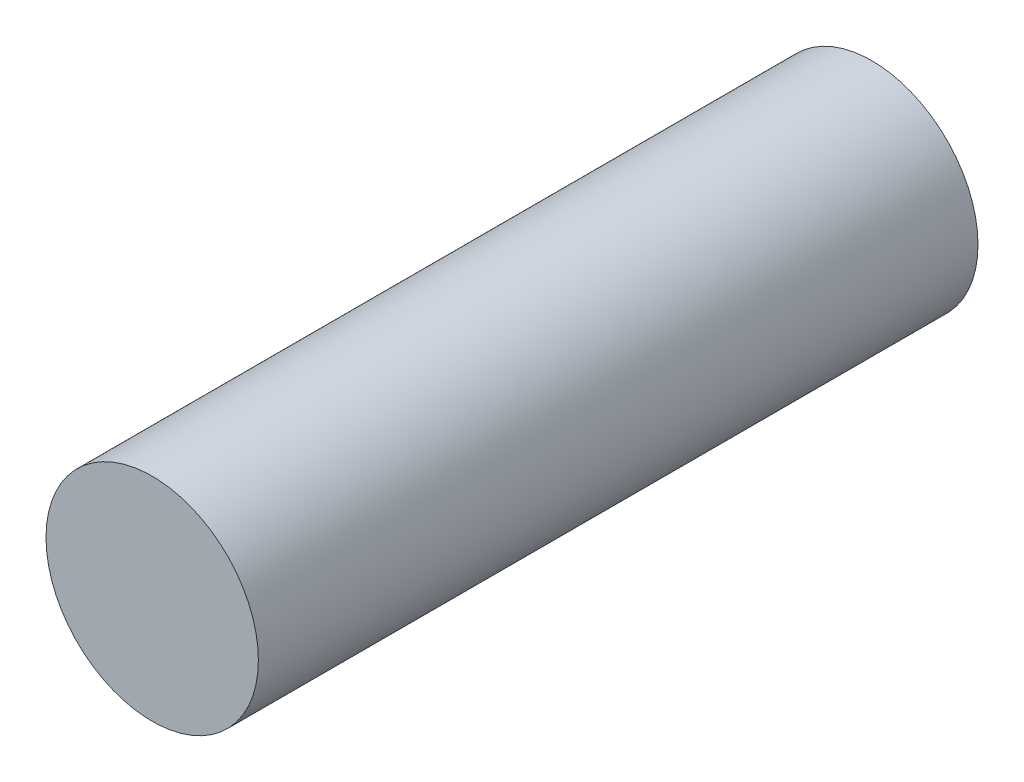
from build123d import *

# Parameters (mm, degrees)
CURVESKETCH_R   = 1.731
CURVEBOSS_DEPTH = 11.731


with BuildPart() as part:
    # CurveSketch → CurveBoss (new body)
    with BuildSketch(Plane.XY):
        with Locations((-3.719, 5.173)):
            Circle(CURVESKETCH_R)
    extrude(amount=CURVEBOSS_DEPTH)


solid = part.part
